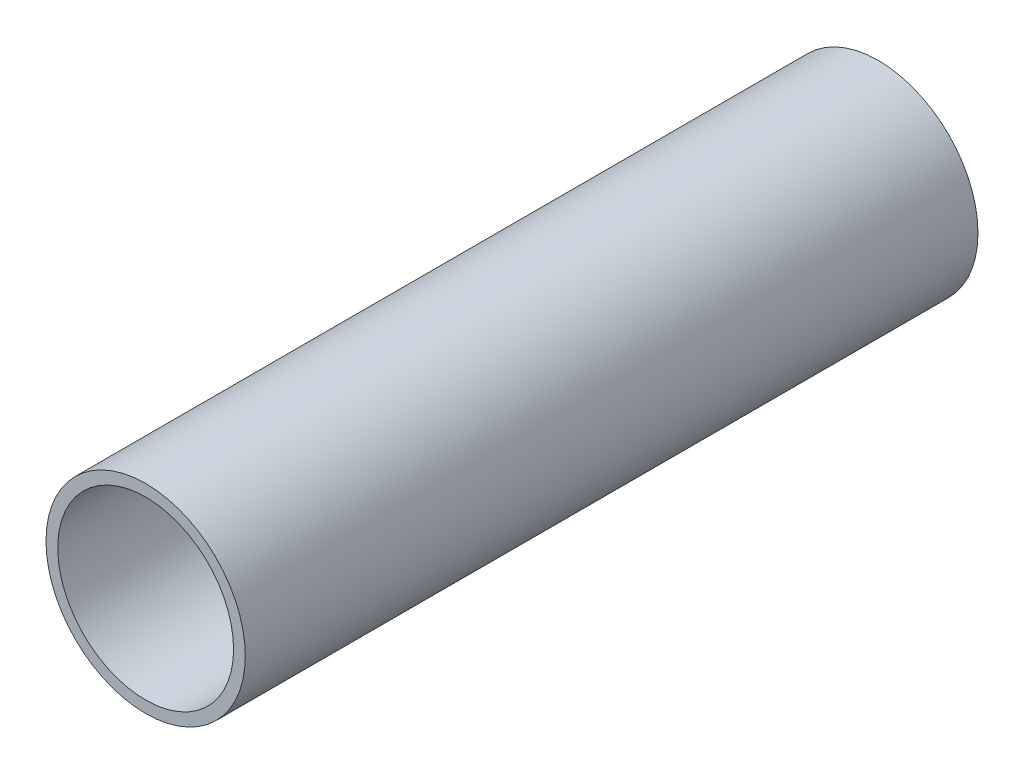
from build123d import *

# Parameters (mm, degrees)
SKETCH1_R           = 13.6
SKETCH1_R_2         = 12
BOSS_EXTRUDE1_DEPTH = 100


with BuildPart() as part:
    # Sketch1 → Boss-Extrude1 (new body)
    with BuildSketch(Plane(origin=(0, 0, 0), x_dir=(0, 1, 0), z_dir=(0, 0, 1))):
        with Locations(Location((0, 0, 0), (0, 0, 270))):
            Circle(SKETCH1_R)
        with Locations(Location((0, 0, 0), (0, 0, 270))):
            Circle(SKETCH1_R_2, mode=Mode.SUBTRACT)
    extrude(amount=BOSS_EXTRUDE1_DEPTH)


solid = part.part
